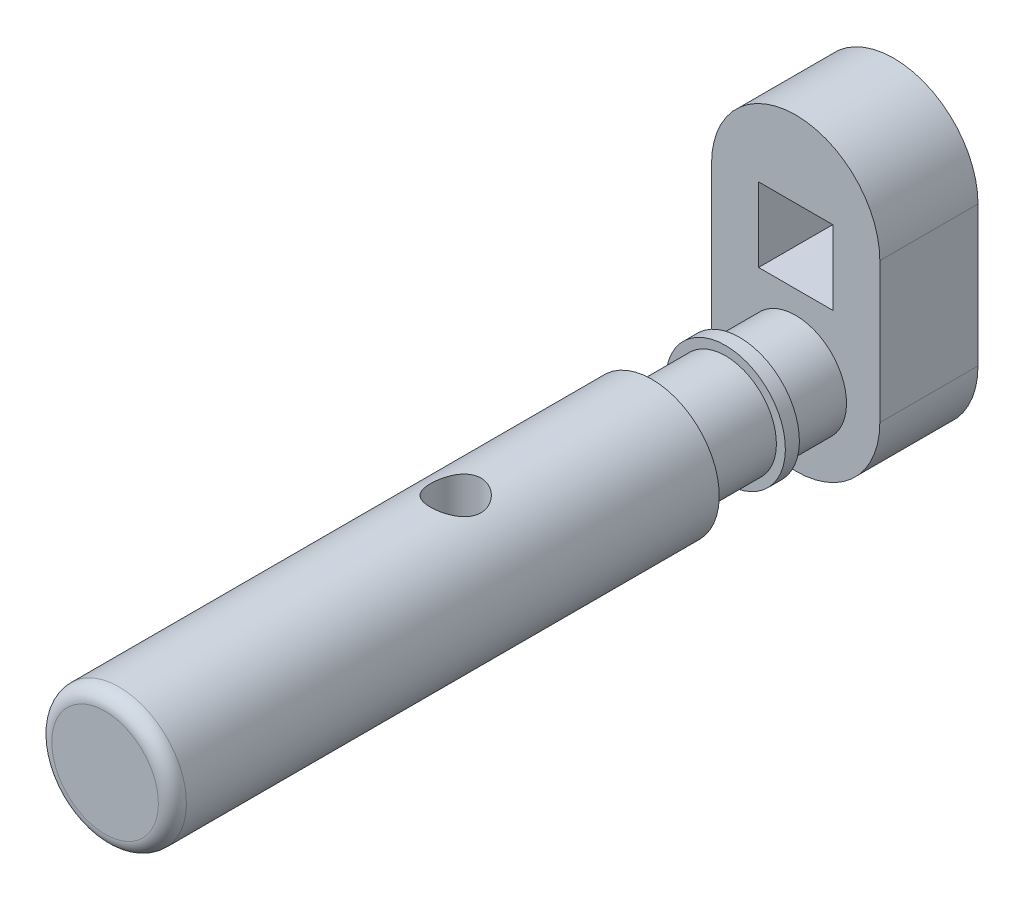
from build123d import *

# Parameters (mm, degrees)
SKETCH1_W           = 5.288
SKETCH1_H           = 5.288
BOSS_EXTRUDE1_DEPTH = 7
FILLET1_R           = 1
FILLET2_R           = 1
SKETCH6_R           = 1.8
CUT_EXTRUDE1_DEPTH  = 58.661920682


with BuildPart() as part:
    # Sketch1 → Boss-Extrude1 (new body)
    with BuildSketch(Plane.XY):
        with BuildLine():
            Line((6, 0), (6, -10))
            ThreePointArc((6, -10), (0, -16), (-6, -10))
            Line((-6, -10), (-6, 0))
            ThreePointArc((-6, 0), (0, 6), (6, 0))
        make_face()
        with Locations((0, -2.1)):
            Rectangle(SKETCH1_W, SKETCH1_H, mode=Mode.SUBTRACT)
    extrude(amount=BOSS_EXTRUDE1_DEPTH)

    # Sketch4 → Revolve1 (revolve)
    with BuildSketch(Plane(origin=(0, 0, 0), x_dir=(0, 0, -1), z_dir=(1, 0, 0)), mode=Mode.PRIVATE) as revolve1_sk:
        Polygon((-7, -13.625), (-11, -13.625), (-11, -14.264510891), (-12, -14.264510891), (-12, -13.625), (-17.25, -13.625), (-17.25, -14.264510891), (-17.25, -14.8), (-20.259244151, -14.8), (-56.24461838, -14.8), (-56.24461838, -13.625), (-56.24461838, -10), (-7, -10), align=None)
    revolve(revolve1_sk.sketch.rotate(Axis((0, -10, 7), (0, 0, 1)), 180), axis=Axis((0, -10, 7), (0, 0, 1)))

    # Fillet1
    fillet1_edges = [part.edges().sort_by_distance(p)[0] for p in [
        (2.644, -2.1, 0),
        (0, 0.544, 0),
        (-2.644, -2.1, 0),
        (0, -4.744, 0),
    ]]
    fillet(fillet1_edges, radius=FILLET1_R)

    # Fillet2
    fillet2_edges = [part.edges().sort_by_distance(p)[0] for p in [
        (0, -14.8, 56.24461838),
    ]]
    fillet(fillet2_edges, radius=FILLET2_R)

    # Sketch6 → Cut-Extrude1 (cut, through all)
    with BuildSketch(Plane(origin=(0, -5.2, 0), x_dir=(1, 0, 0), z_dir=(0, 1, 0))):
        with Locations(Location((0, -31.24461838, 0), (0, 0, 270))):
            Circle(SKETCH6_R)
    extrude(amount=-CUT_EXTRUDE1_DEPTH, mode=Mode.SUBTRACT)


solid = part.part
